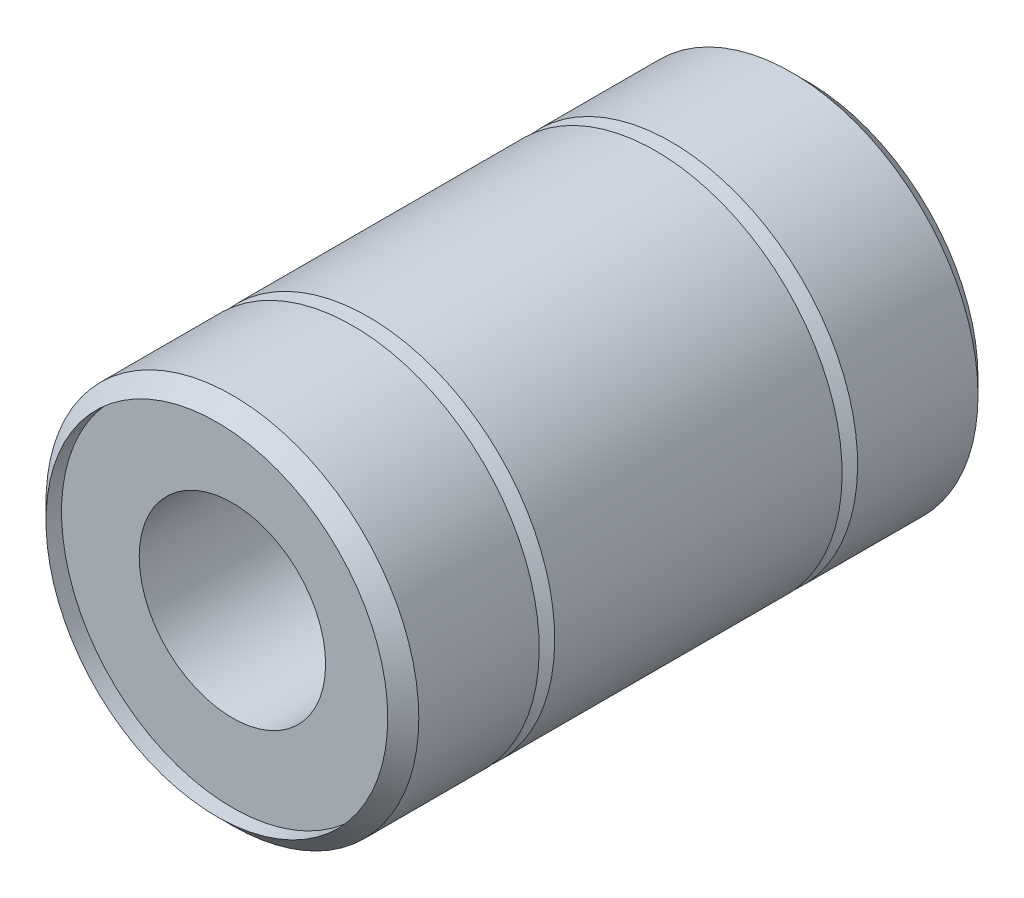
from build123d import *

# Parameters (mm, degrees)
SKETCH_1_R          = 6
SKETCH_1_R_2        = 3
EXTRUDE_1_DEPTH     = 9.5
CHAMFER_1_SIZE      = 0.5
SKETCH_2_R          = 5.5
CUT_EXTRUDE_1_DEPTH = 0.5


with BuildPart() as part:
    # 스케치1 → 보스-돌출1 (new, symmetric)
    with BuildSketch(Plane.XY):
        Circle(SKETCH_1_R)
        Circle(SKETCH_1_R_2, mode=Mode.SUBTRACT)
    extrude(amount=EXTRUDE_1_DEPTH, both=True)

    # 모따기1
    chamfer_1_edges = [part.edges().sort_by_distance(p)[0] for p in [
        (-6, 0, -9.5),
        (-6, 0, 9.5),
    ]]
    chamfer(chamfer_1_edges, length=CHAMFER_1_SIZE)

    # 스케치2 → 컷-돌출1 (cut)
    with BuildSketch(Plane.XY.offset(9.5)):
        Circle(SKETCH_2_R)
    cut_extrude_1 = extrude(amount=-CUT_EXTRUDE_1_DEPTH, mode=Mode.SUBTRACT)

    # 대칭 복사1: 컷-돌출1 across plane
    add(cut_extrude_1.mirror(Plane.XY), mode=Mode.SUBTRACT)

    # 스케치3 → 컷-회전1 (revolve, cut)
    with BuildSketch(Plane(origin=(0, 0, 0), x_dir=(0, 0, -1), z_dir=(1, 0, 0)), mode=Mode.PRIVATE) as cut_revolve_1_sk:
        Polygon((-4.625, 6), (-5.125, 6), (-4.875, 5.566987298), align=None)
        Polygon((4.625, 6), (5.125, 6), (4.875, 5.566987298), align=None)
    revolve(cut_revolve_1_sk.sketch.rotate(Axis((0, 0, 9), (0, 0, -1)), 180), axis=Axis((0, 0, 9), (0, 0, -1)), mode=Mode.SUBTRACT)


solid = part.part
